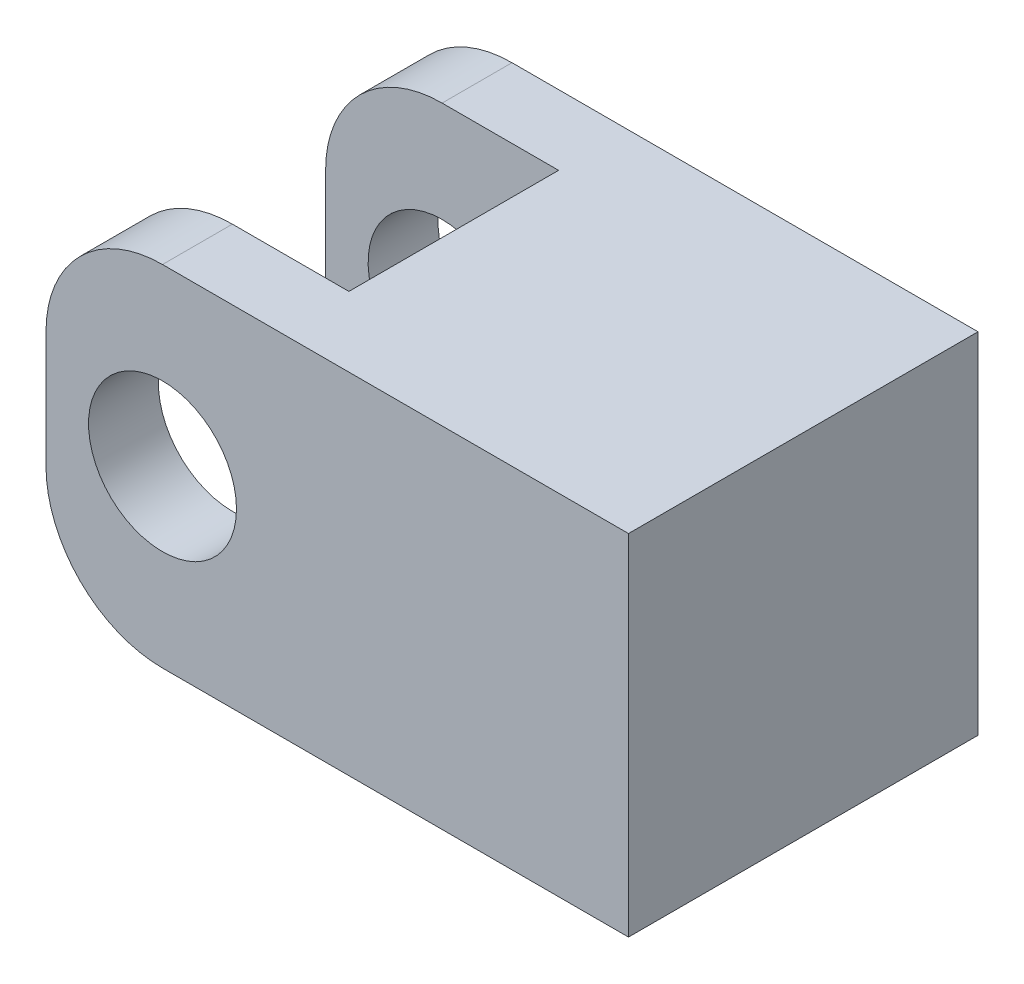
from build123d import *

# Parameters (mm, degrees)
ESQUISSE1_W             = 50
ESQUISSE1_H             = 30
BOSS_EXTRU_1_DEPTH      = 30
ENL_V_MAT_EXTRU_1_REACH = 43.833
ESQUISSE2_R             = 6.35
CONG_1_R                = 10
ESQUISSE3_W             = 18
ESQUISSE3_H             = 30
ENL_V_MAT_EXTRU_2_DEPTH = 20


with BuildPart() as part:
    # Esquisse1 → Boss.-Extru.1 (new body)
    with BuildSketch(Plane.XY):
        Rectangle(ESQUISSE1_W, ESQUISSE1_H)
    extrude(amount=BOSS_EXTRU_1_DEPTH)

    # Esquisse2 → Enlèv. mat.-Extru.1 (cut, up to next)
    with BuildSketch(Plane.XY.offset(30), mode=Mode.PRIVATE) as enl_v_mat_extru_1_sk1:
        with Locations((-15, 0)):
            Circle(ESQUISSE2_R)
    enl_v_mat_extru_1_tool1 = extrude(enl_v_mat_extru_1_sk1.sketch, amount=-ENL_V_MAT_EXTRU_1_REACH, mode=Mode.PRIVATE) & part.part
    add(enl_v_mat_extru_1_tool1.solids().sort_by_distance((-15, 0, 30))[0], mode=Mode.SUBTRACT)

    # Congé1
    cong_1_edges = [part.edges().sort_by_distance(p)[0] for p in [
        (-25, -15, 15),
        (-25, 15, 15),
    ]]
    fillet(cong_1_edges, radius=CONG_1_R)

    # Esquisse3 → Enlèv. mat.-Extru.2 (cut)
    with BuildSketch(Plane.ZY.offset(25)):
        with Locations((15, 0)):
            Rectangle(ESQUISSE3_W, ESQUISSE3_H)
    extrude(amount=-ENL_V_MAT_EXTRU_2_DEPTH, mode=Mode.SUBTRACT)


solid = part.part
